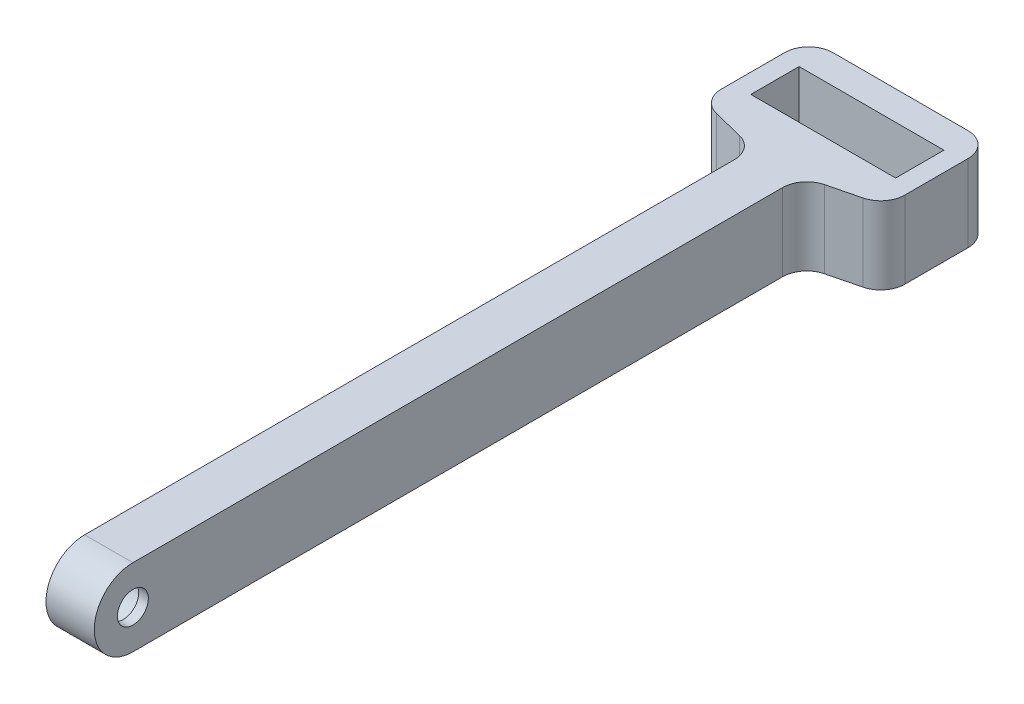
from build123d import *

# Parameters (mm, degrees)
ESQUISSE1_R             = 1.6
BOSS_EXTRU_1_DEPTH      = 5
ESQUISSE3_W             = 15
ESQUISSE3_H             = 5
BOSS_EXTRU_2_DEPTH      = 8
ESQUISSE4_R             = 2.4
ENL_V_MAT_EXTRU_1_DEPTH = 4
CONG_2_R                = 2.5


with BuildPart() as part:
    # Esquisse1 → Boss.-Extru.1 (new body)
    with BuildSketch(Plane(origin=(0, 0, 0), x_dir=(0, 0, -1), z_dir=(1, 0, 0))):
        with BuildLine():
            Line((-30, 4), (41, 4))
            Line((41, 4), (41, -4))
            Line((41, -4), (-30, -4))
            ThreePointArc((-30, -4), (-34, 0), (-30, 4))
        make_face()
        with Locations((-30, 0)):
            Circle(ESQUISSE1_R, mode=Mode.SUBTRACT)
    extrude(amount=BOSS_EXTRU_1_DEPTH)

    # Esquisse3 → Boss.-Extru.2 (add)
    # profile 1 of 3: a face of its own
    with BuildSketch(Plane(origin=(0, 4, 0), x_dir=(1, 0, 0), z_dir=(0, 1, 0))):
        Polygon((5, 41), (12, 41), (12, 52), (-7, 52), (-7, 41), (0, 41), align=None)
        with Locations((2.5, 46.5)):
            Rectangle(ESQUISSE3_W, ESQUISSE3_H, mode=Mode.SUBTRACT)
    # profile 2 of 3: a face of its own
    with BuildSketch(Plane(origin=(0, 4, 0), x_dir=(1, 0, 0), z_dir=(0, 1, 0))):
        Polygon((0, 39.25), (0, 41), (-7, 41), align=None)
    # profile 3 of 3: a face of its own
    with BuildSketch(Plane(origin=(0, 4, 0), x_dir=(1, 0, 0), z_dir=(0, 1, 0))):
        Polygon((12, 41), (5, 41), (5, 39.25), align=None)
    extrude(amount=-BOSS_EXTRU_2_DEPTH)

    # Esquisse4 → Enlèv. mat.-Extru.1 (cut)
    with BuildSketch(Plane.ZY):
        with Locations((30, 0)):
            Circle(ESQUISSE4_R)
    extrude(amount=-ENL_V_MAT_EXTRU_1_DEPTH, mode=Mode.SUBTRACT)

    # Congé2
    cong_2_edges = [part.edges().sort_by_distance(p)[0] for p in [
        (0, 0, -39.25),
        (-7, 0, -41),
        (-7, 0, -52),
        (12, 0, -52),
        (12, 0, -41),
        (5, 0, -39.25),
    ]]
    fillet(cong_2_edges, radius=CONG_2_R)


solid = part.part
